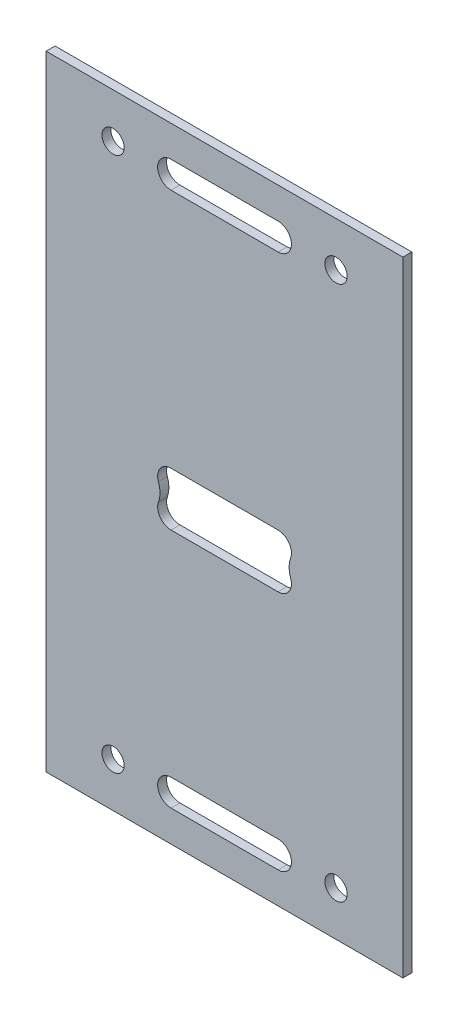
from build123d import *

# Parameters (mm, degrees)
SKETCH1_W           = 40
SKETCH1_H           = 70
SKETCH1_R           = 1.25
BOSS_EXTRUDE1_DEPTH = 1
CUT_EXTRUDE1_DEPTH  = 41.323690307
FILLET1_R           = 3


with BuildPart() as part:
    # Sketch1 → Boss-Extrude1 (new body)
    with BuildSketch(Plane.XY):
        Rectangle(SKETCH1_W, SKETCH1_H)
        with Locations((-12.5, 30)):
            Circle(SKETCH1_R, mode=Mode.SUBTRACT)
        with Locations((12.5, 30)):
            Circle(SKETCH1_R, mode=Mode.SUBTRACT)
        with Locations((-12.5, -30)):
            Circle(SKETCH1_R, mode=Mode.SUBTRACT)
        with Locations((12.5, -30)):
            Circle(SKETCH1_R, mode=Mode.SUBTRACT)
    extrude(amount=BOSS_EXTRUDE1_DEPTH)

    # Sketch2 → Cut-Extrude1 (cut, through all)
    with BuildSketch(Plane.XY.offset(1)):
        with BuildLine():
            Line((-6, 31.5), (6, 31.5))
            ThreePointArc((6, 31.5), (7.5, 30), (6, 28.5))
            Line((6, 28.5), (-6, 28.5))
            ThreePointArc((-6, 28.5), (-7.5, 30), (-6, 31.5))
        make_face()
        with BuildLine():
            Line((-6, 1.5), (6, 1.5))
            ThreePointArc((6, 1.5), (7.5, 0), (6, -1.5))
            ThreePointArc((6, -1.5), (7.5, -3), (6, -4.5))
            Line((6, -4.5), (-6, -4.5))
            ThreePointArc((-6, -4.5), (-7.5, -3), (-6, -1.5))
            ThreePointArc((-6, -1.5), (-7.5, 0), (-6, 1.5))
        make_face()
        with BuildLine():
            Line((-6, -28.5), (6, -28.5))
            ThreePointArc((6, -28.5), (7.5, -30), (6, -31.5))
            Line((6, -31.5), (-6, -31.5))
            ThreePointArc((-6, -31.5), (-7.5, -30), (-6, -28.5))
        make_face()
    extrude(amount=-CUT_EXTRUDE1_DEPTH, mode=Mode.SUBTRACT)

    # Fillet1
    fillet1_edges = [part.edges().sort_by_distance(p)[0] for p in [
        (-6, -1.5, 0.5),
        (6, -1.5, 0.5),
    ]]
    fillet(fillet1_edges, radius=FILLET1_R)


solid = part.part
